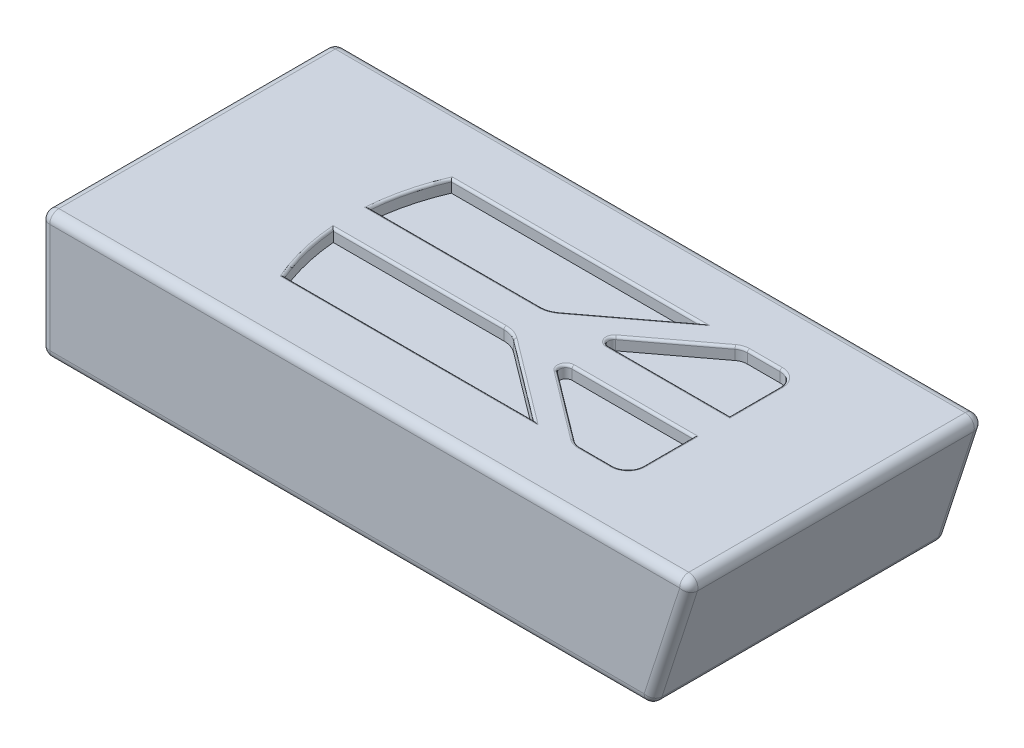
from build123d import *

# Parameters (mm, degrees)
SKETCH1_W           = 49.022
SKETCH1_H           = 8.382
BOSS_EXTRUDE1_DEPTH = 11.176
FILLET1_R           = 0.508
BOSS_EXTRUDE2_DEPTH = 12.319
BOSS_EXTRUDE3_DEPTH = 1.016
BOSS_EXTRUDE4_DEPTH = 1.016
FILLET2_R           = 0.762
SKETCH7_W           = 3.6576
SKETCH7_H           = 0.762
CUT_EXTRUDE2_DEPTH  = 8.89
FILLET3_R           = 0.0762
CUT_EXTRUDE3_DEPTH  = 1.016
FILLET5_R           = 1.27
FILLET6_R           = 0.2032
FILLET7_R           = 1.27
FILLET8_R           = 0.2032


with BuildPart() as part:
    # Sketch1 → Boss-Extrude1 (new, symmetric)
    with BuildSketch(Plane.XY):
        with Locations((24.511, 4.191)):
            Rectangle(SKETCH1_W, SKETCH1_H)
    extrude(amount=BOSS_EXTRUDE1_DEPTH, both=True)

    # Fillet1
    fillet1_edges = [part.edges().sort_by_distance(p)[0] for p in [
        (49.022, 4.191, 11.176),
        (24.511, 8.382, 11.176),
        (0, 4.191, 11.176),
        (24.511, 8.382, -11.176),
        (49.022, 4.191, -11.176),
        (24.511, 0, -11.176),
        (0, 4.191, -11.176),
        (24.511, 0, 11.176),
        (0, 8.382, 0),
        (49.022, 8.382, 0),
        (49.022, 0, 0),
        (0, 0, 0),
    ]]
    fillet(fillet1_edges, radius=FILLET1_R)


with BuildPart() as body_2:
    # Sketch2 → Boss-Extrude2 (new, symmetric)
    with BuildSketch(Plane.XY):
        Polygon((-1.143, 9.525), (53.353410528, 9.525), (49.887167208, -1.143), (-1.143, -1.143), align=None)
        Polygon((-0.127, -0.127), (-0.127, 8.509), (51.955006497, 8.509), (49.149, -0.127), align=None, mode=Mode.SUBTRACT)
    extrude(amount=BOSS_EXTRUDE2_DEPTH, both=True)

    # Sketch3 → Boss-Extrude3 (add)
    with BuildSketch(Plane.XY.offset(12.319)):
        Polygon((51.955006497, 8.509), (-0.127, 8.509), (-0.127, -0.127), (49.149, -0.127), align=None)
    extrude(amount=-BOSS_EXTRUDE3_DEPTH)

    # Sketch4 → Boss-Extrude4 (add)
    with BuildSketch(Plane(origin=(0, 0, -12.319), x_dir=(-1, 0, 0), z_dir=(0, 0, -1))):
        Polygon((-51.955006497, 8.509), (0.127, 8.509), (0.127, -0.127), (-49.149, -0.127), align=None)
    extrude(amount=-BOSS_EXTRUDE4_DEPTH)

    # Fillet2
    fillet2_edges = [body_2.edges().sort_by_distance(p)[0] for p in [
        (51.620288868, 4.191, 12.319),
        (26.105205264, 9.525, 12.319),
        (-0.127, 8.509, 0),
        (-1.143, 4.191, 12.319),
        (26.105205264, 9.525, -12.319),
        (51.620288868, 4.191, -12.319),
        (24.372083604, -1.143, -12.319),
        (-1.143, 4.191, -12.319),
        (24.372083604, -1.143, 12.319),
        (-1.143, 9.525, 0),
        (53.353410528, 9.525, 0),
        (49.887167208, -1.143, 0),
        (-1.143, -1.143, 0),
    ]]
    fillet(fillet2_edges, radius=FILLET2_R)


with BuildPart() as cut_extrude2_tool:
    # Sketch7 → Cut-Extrude2 (new body)
    with BuildSketch(Plane.ZY.offset(1.143)):
        with Locations((-5.6388, 4.826)):
            Rectangle(SKETCH7_W, SKETCH7_H)
        with Locations((5.6388, 4.826)):
            Rectangle(SKETCH7_W, SKETCH7_H)
    extrude(amount=-CUT_EXTRUDE2_DEPTH)


with BuildPart() as part_1:
    add(part.part)

    # Cut-Extrude2: cut by cut_extrude2_tool
    add(cut_extrude2_tool.part, mode=Mode.SUBTRACT)


with BuildPart() as body_2_1:
    add(body_2.part)

    # Cut-Extrude2: cut by cut_extrude2_tool
    add(cut_extrude2_tool.part, mode=Mode.SUBTRACT)

    # Fillet3
    fillet3_edges = [body_2_1.edges().sort_by_distance(p)[0] for p in [
        (-1.143, 4.826, -7.4676),
        (-1.143, 4.445, -5.6388),
        (-1.143, 4.826, -3.81),
        (-1.143, 5.207, -5.6388),
        (-1.143, 4.826, 3.81),
        (-1.143, 4.445, 5.6388),
        (-1.143, 4.826, 7.4676),
        (-1.143, 5.207, 5.6388),
    ]]
    fillet(fillet3_edges, radius=FILLET3_R)

    # Sketch8 → Cut-Extrude3 (cut)
    with BuildSketch(Plane(origin=(0, 9.525, 0), x_dir=(1, 0, 0), z_dir=(0, 1, 0))):
        with BuildLine():
            Line((34.727807504, 6.985), (13.899807504, 6.985))
            ThreePointArc((13.899807504, 6.985), (13.000288388, 4.308822678), (12.535721549, 1.524))
            Line((12.535721549, 1.524), (26.800918044, 1.524))
            ThreePointArc((26.800918044, 1.524), (27.445681106, 1.629006333), (28.023806171, 1.933172644))
            Line((28.023806171, 1.933172644), (34.727807504, 6.985))
        make_face()
        with BuildLine():
            Line((26.800918044, -1.524), (12.535721549, -1.524))
            ThreePointArc((12.535721549, -1.524), (13.000288388, -4.308822678), (13.899807504, -6.985))
            Line((13.899807504, -6.985), (34.727807504, -6.985))
            Line((34.727807504, -6.985), (28.023806171, -1.933172644))
            ThreePointArc((28.023806171, -1.933172644), (27.445681106, -1.629006333), (26.800918044, -1.524))
        make_face()
        with BuildLine():
            Line((42.652607504, 6.985), (38.233007504, 6.985))
            Line((38.233007504, 6.985), (32.198545663, 2.437706839))
            ThreePointArc((32.198545663, 2.437706839), (32.022519278, 1.870809235), (32.504267695, 1.524))
            Line((32.504267695, 1.524), (42.652607504, 1.524))
            Line((42.652607504, 1.524), (42.652607504, 6.985))
        make_face()
        with BuildLine():
            Line((42.652607504, -6.985), (42.652607504, -1.524))
            Line((42.652607504, -1.524), (32.504267695, -1.524))
            ThreePointArc((32.504267695, -1.524), (32.022519278, -1.870809235), (32.198545663, -2.437706839))
            Line((32.198545663, -2.437706839), (38.233007504, -6.985))
            Line((38.233007504, -6.985), (42.652607504, -6.985))
        make_face()
    cut_extrude3 = extrude(amount=-CUT_EXTRUDE3_DEPTH, mode=Mode.SUBTRACT)

    # Fillet5
    fillet5_edges = [body_2_1.edges().sort_by_distance(p)[0] for p in [
        (38.233007504, 9.017, -6.985),
        (42.652607504, 9.017, -6.985),
        (42.652607504, 9.017, 6.985),
        (38.233007504, 9.017, 6.985),
    ]]
    fillet(fillet5_edges, radius=FILLET5_R)

    # Fillet6
    fillet6_edges = [body_2_1.edges().sort_by_distance(p)[0] for p in [
        (24.313807504, 9.525, -6.985),
        (19.668319797, 9.525, -1.524),
        (27.445681106, 9.525, -1.629006333),
        (31.375806838, 9.525, -4.459086322),
        (13.000288388, 9.525, -4.308822678),
        (27.445681106, 9.525, 1.629006333),
        (31.375806838, 9.525, 4.459086322),
        (24.313807504, 9.525, 6.985),
        (19.668319797, 9.525, 1.524),
        (13.000288388, 9.525, 4.308822678),
        (32.022519278, 9.525, -1.870809235),
        (37.5784376, 9.525, -1.524),
        (37.5784376, 9.525, 1.524),
        (42.652607504, 9.525, 3.6195),
        (32.022519278, 9.525, 1.870809235),
        (35.046092072, 9.525, -4.583486968),
        (40.020275532, 9.525, -6.985),
        (40.020275532, 9.525, 6.985),
        (35.046092072, 9.525, 4.583486968),
        (42.652607504, 9.525, -3.6195),
        (38.254966647, 9.525, -6.919371042),
        (38.254966647, 9.525, 6.919371042),
        (42.280633117, 9.525, 6.613025612),
        (42.280633117, 9.525, -6.613025612),
    ]]
    fillet(fillet6_edges, radius=FILLET6_R)

    # Mirror3: Cut-Extrude3 across plane
    add(cut_extrude3.mirror(Plane.ZX.offset(4.191)), mode=Mode.SUBTRACT)

    # Fillet7
    fillet7_edges = [body_2_1.edges().sort_by_distance(p)[0] for p in [
        (38.233007504, -0.635, -6.985),
        (42.652607504, -0.635, -6.985),
        (42.652607504, -0.635, 6.985),
        (38.233007504, -0.635, 6.985),
    ]]
    fillet(fillet7_edges, radius=FILLET7_R)

    # Fillet8
    fillet8_edges = [body_2_1.edges().sort_by_distance(p)[0] for p in [
        (19.668319797, -1.143, -1.524),
        (27.445681106, -1.143, -1.629006333),
        (31.375806838, -1.143, -4.459086322),
        (13.000288388, -1.143, -4.308822678),
        (24.313807504, -1.143, -6.985),
        (13.000288388, -1.143, 4.308822678),
        (27.445681106, -1.143, 1.629006333),
        (31.375806838, -1.143, 4.459086322),
        (24.313807504, -1.143, 6.985),
        (19.668319797, -1.143, 1.524),
        (32.022519278, -1.143, -1.870809235),
        (37.5784376, -1.143, -1.524),
        (37.5784376, -1.143, 1.524),
        (42.652607504, -1.143, 3.6195),
        (32.022519278, -1.143, 1.870809235),
        (35.046092072, -1.143, 4.583486968),
        (40.020275532, -1.143, 6.985),
        (40.020275532, -1.143, -6.985),
        (35.046092072, -1.143, -4.583486968),
        (42.652607504, -1.143, -3.6195),
        (38.254966647, -1.143, 6.919371042),
        (42.280633117, -1.143, 6.613025612),
        (38.254966647, -1.143, -6.919371042),
        (42.280633117, -1.143, -6.613025612),
    ]]
    fillet(fillet8_edges, radius=FILLET8_R)


solid = Compound([part_1.part, body_2_1.part])
